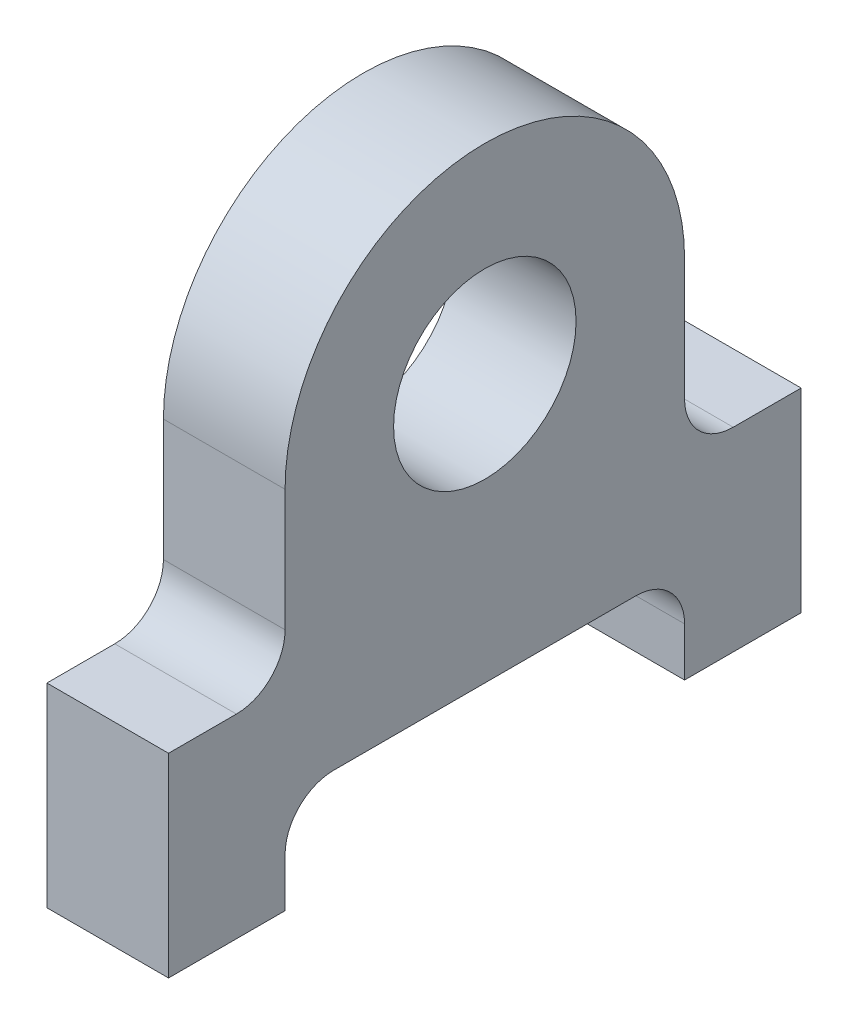
from build123d import *

# Parameters (mm, degrees)
SKETCH1_R           = 4.7625
BOSS_EXTRUDE1_DEPTH = 6.35


with BuildPart() as part:
    # Sketch1 → Boss-Extrude1 (new body)
    with BuildSketch(Plane(origin=(0, 0, 0), x_dir=(0, 0, -1), z_dir=(1, 0, 0))):
        with BuildLine():
            Line((-16.51, -19.05), (-10.4267, -19.05))
            Line((-10.4267, -19.05), (-10.4267, -16.51))
            ThreePointArc((-10.4267, -16.51), (-9.682751224, -14.713948776), (-7.8867, -13.97))
            Line((-7.8867, -13.97), (7.8867, -13.97))
            ThreePointArc((7.8867, -13.97), (9.682751224, -14.713948776), (10.4267, -16.51))
            Line((10.4267, -16.51), (10.4267, -19.05))
            Line((10.4267, -19.05), (16.51, -19.05))
            Line((16.51, -19.05), (16.51, -8.89))
            Line((16.51, -8.89), (12.9667, -8.89))
            ThreePointArc((12.9667, -8.89), (11.170648776, -8.146051224), (10.4267, -6.35))
            Line((10.4267, -6.35), (10.4267, 0))
            ThreePointArc((10.4267, 0), (0, 10.4267), (-10.4267, 0))
            Line((-10.4267, 0), (-10.4267, -6.35))
            ThreePointArc((-10.4267, -6.35), (-11.170648776, -8.146051224), (-12.9667, -8.89))
            Line((-12.9667, -8.89), (-16.51, -8.89))
            Line((-16.51, -8.89), (-16.51, -19.05))
        make_face()
        with Locations(Location((0, 0, 0), (0, 0, 180))):
            Circle(SKETCH1_R, mode=Mode.SUBTRACT)
    extrude(amount=BOSS_EXTRUDE1_DEPTH)


solid = part.part
